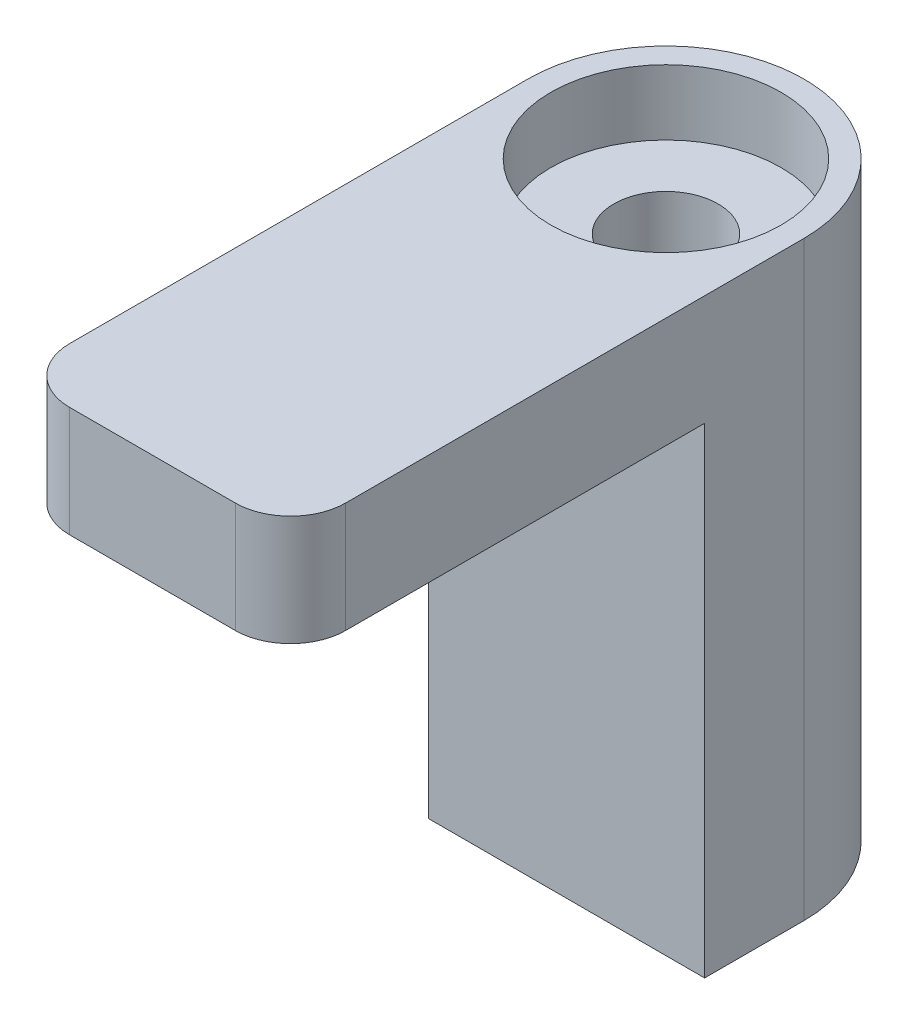
from build123d import *

# Parameters (mm, degrees)
BOSS_EXTRUDE1_DEPTH                              = 22.098
BOSS_EXTRUDE2_DEPTH                              = 5.08
FILLET1_R                                        = 2.54
CBORE_FOR_M4_HEX_HEAD_MACHINE_SCREW1_D           = 4.5
CBORE_FOR_M4_HEX_HEAD_MACHINE_SCREW1_CBORE_D     = 10.59
CBORE_FOR_M4_HEX_HEAD_MACHINE_SCREW1_CBORE_DEPTH = 3
M4_CLEARANCE_HOLE1_D                             = 4.8


with BuildPart() as part:
    # Sketch1 → Boss-Extrude1 (new body)
    with BuildSketch(Plane(origin=(0, 0, 0), x_dir=(1, 0, 0), z_dir=(0, 1, 0))):
        with BuildLine():
            Line((-6.35, 4.572), (-6.35, 0))
            Line((-6.35, 0), (6.35, 0))
            Line((6.35, 0), (6.35, 4.572))
            ThreePointArc((6.35, 4.572), (0, 10.922), (-6.35, 4.572))
        make_face()
    extrude(amount=BOSS_EXTRUDE1_DEPTH)

    # Sketch2 → Boss-Extrude2 (add)
    with BuildSketch(Plane(origin=(0, 22.098, 0), x_dir=(1, 0, 0), z_dir=(0, 1, 0))):
        with BuildLine():
            Line((-6.35, 0), (-6.35, -19.05))
            Line((-6.35, -19.05), (6.35, -19.05))
            Line((6.35, -19.05), (6.35, 0))
            Line((6.35, 0), (6.35, 4.572))
            ThreePointArc((6.35, 4.572), (0, 10.922), (-6.35, 4.572))
            Line((-6.35, 4.572), (-6.35, 0))
        make_face()
    extrude(amount=BOSS_EXTRUDE2_DEPTH)

    # Fillet1
    fillet1_edges = [part.edges().sort_by_distance(p)[0] for p in [
        (6.35, 24.638, 19.05),
        (-6.35, 24.638, 19.05),
    ]]
    fillet(fillet1_edges, radius=FILLET1_R)

    # CBORE for M4 Hex Head Machine Screw1 (through all)
    with Locations(Plane(origin=(0, 27.178, 0), x_dir=(1, 0, 0), z_dir=(0, 1, 0))):
        with Locations((0, 4.572)):
            CounterBoreHole(CBORE_FOR_M4_HEX_HEAD_MACHINE_SCREW1_D / 2, CBORE_FOR_M4_HEX_HEAD_MACHINE_SCREW1_CBORE_D / 2, CBORE_FOR_M4_HEX_HEAD_MACHINE_SCREW1_CBORE_DEPTH)

    # M4 Clearance Hole1 (through all)
    with Locations(Plane(origin=(0, 24.178, 0), x_dir=(1, 0, 0), z_dir=(0, 1, 0))):
        with Locations((0, 4.572)):
            Hole(M4_CLEARANCE_HOLE1_D / 2)


solid = part.part
